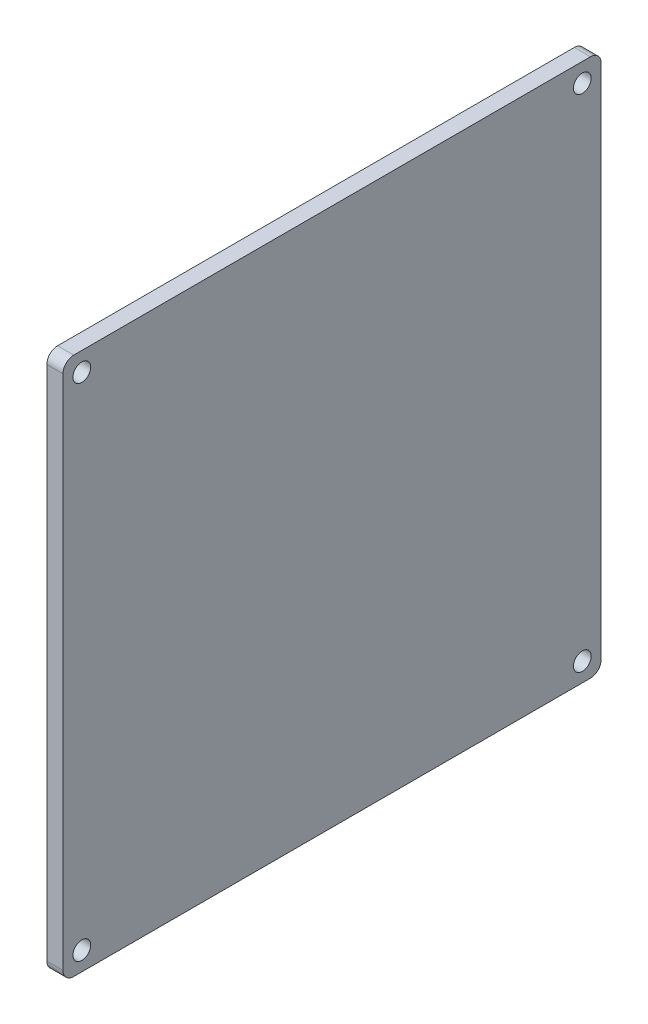
from build123d import *

# Parameters (mm, degrees)
SKETCH_1_W          = 100
SKETCH_1_H          = 100
EXTRUDE_1_DEPTH     = 3
SKETCH_2_R          = 1.65
CUT_EXTRUDE_1_DEPTH = 3
FILLET_1_R          = 2
FILLET_2_R          = 2


with BuildPart() as part:
    # 草图1 → 凸台-拉伸1 (new body)
    with BuildSketch(Plane(origin=(0, 0, 0), x_dir=(0, 0, -1), z_dir=(1, 0, 0))):
        with Locations((50, -50)):
            Rectangle(SKETCH_1_W, SKETCH_1_H)
    extrude(amount=EXTRUDE_1_DEPTH)

    # 草图2 → 切除-拉伸1 (cut)
    with BuildSketch(Plane(origin=(3, 0, 0), x_dir=(0, 0, -1), z_dir=(1, 0, 0))):
        with Locations((3.5, -3.5)):
            Circle(SKETCH_2_R)
        with Locations(Location((96.5, -3.5, 0), (0, 0, 180))):
            Circle(SKETCH_2_R)
        with Locations((96.5, -96.5)):
            Circle(SKETCH_2_R)
        with Locations(Location((3.5, -96.5, 0), (0, 0, 180))):
            Circle(SKETCH_2_R)
    extrude(amount=-CUT_EXTRUDE_1_DEPTH, mode=Mode.SUBTRACT)

    # 圆角1
    fillet_1_edges = [part.edges().sort_by_distance(p)[0] for p in [
        (1.5, 0, -100),
    ]]
    fillet(fillet_1_edges, radius=FILLET_1_R)

    # 圆角2
    fillet_2_edges = [part.edges().sort_by_distance(p)[0] for p in [
        (1.5, 0, 0),
        (1.5, -100, -100),
        (1.5, -100, 0),
    ]]
    fillet(fillet_2_edges, radius=FILLET_2_R)


solid = part.part
